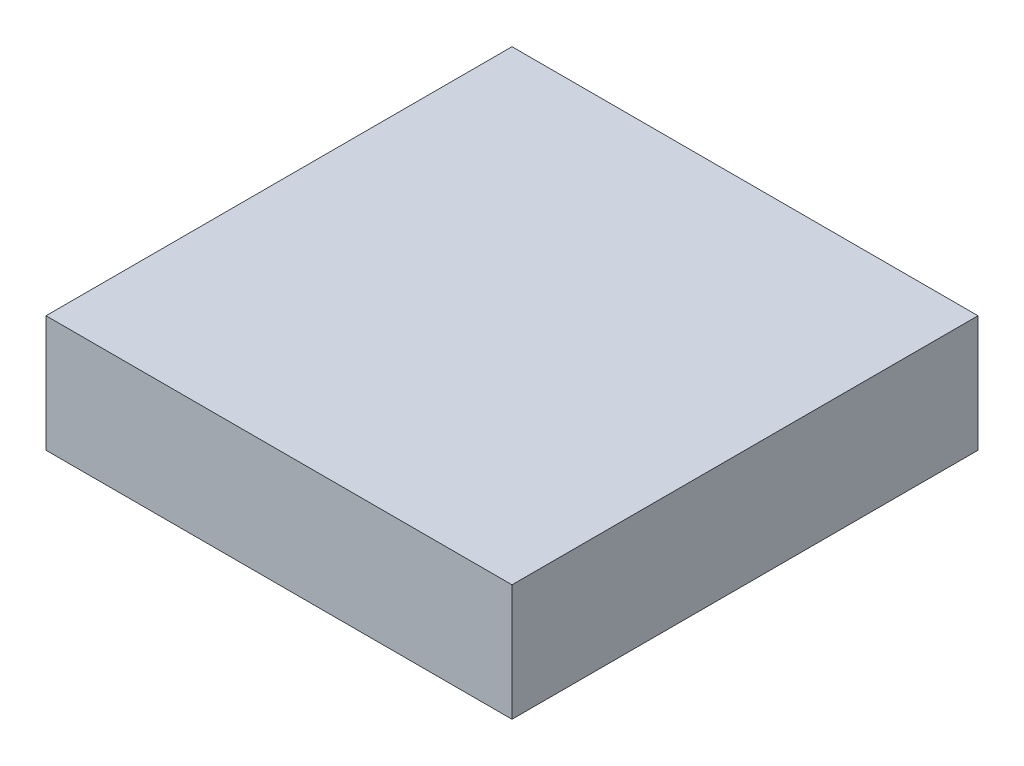
from build123d import *

# Parameters (mm, degrees)
SKETCH_1_W      = 24
SKETCH_1_H      = 24
EXTRUDE_1_DEPTH = 6


with BuildPart() as part:
    # Эскиз1 → Бобышка-Вытянуть1 (new body)
    with BuildSketch(Plane(origin=(0, 0, 0), x_dir=(1, 0, 0), z_dir=(0, 1, 0))):
        Rectangle(SKETCH_1_W, SKETCH_1_H)
    extrude(amount=EXTRUDE_1_DEPTH)


solid = part.part
